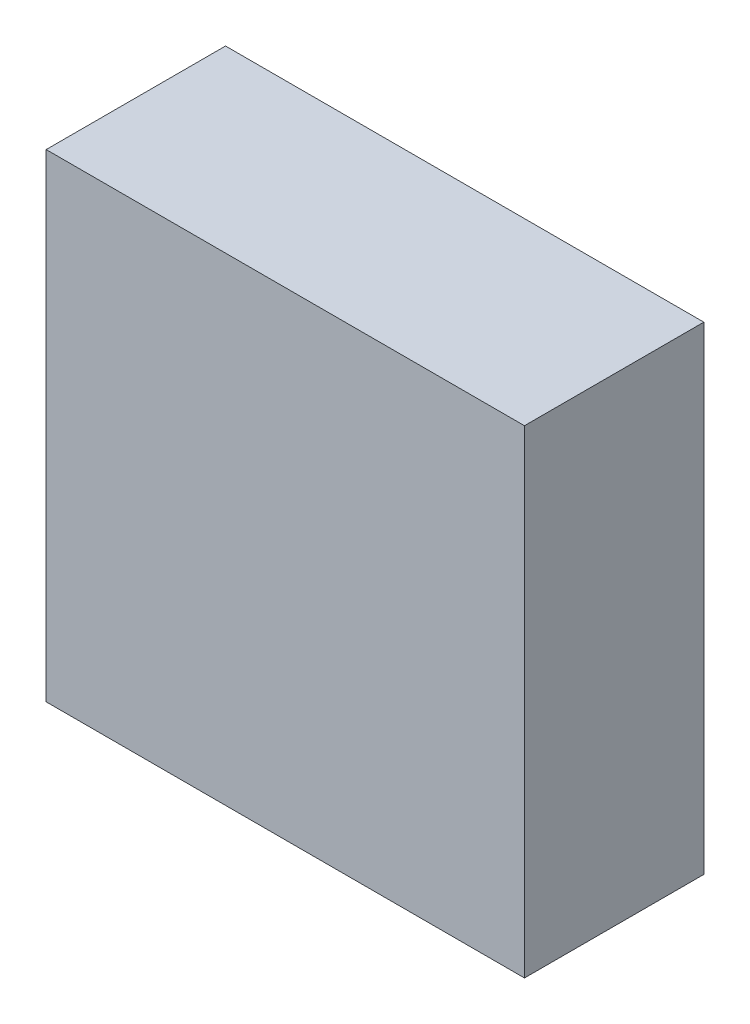
from build123d import *

# Parameters (mm, degrees)
SKETCH_1_W      = 8
SKETCH_1_H      = 8
EXTRUDE_1_DEPTH = 3


with BuildPart() as part:
    # 草图1 → 凸台-拉伸1 (new body)
    with BuildSketch(Plane.XY):
        with Locations((0.394756957, 0.241064666)):
            Rectangle(SKETCH_1_W, SKETCH_1_H)
    extrude(amount=EXTRUDE_1_DEPTH)


solid = part.part
